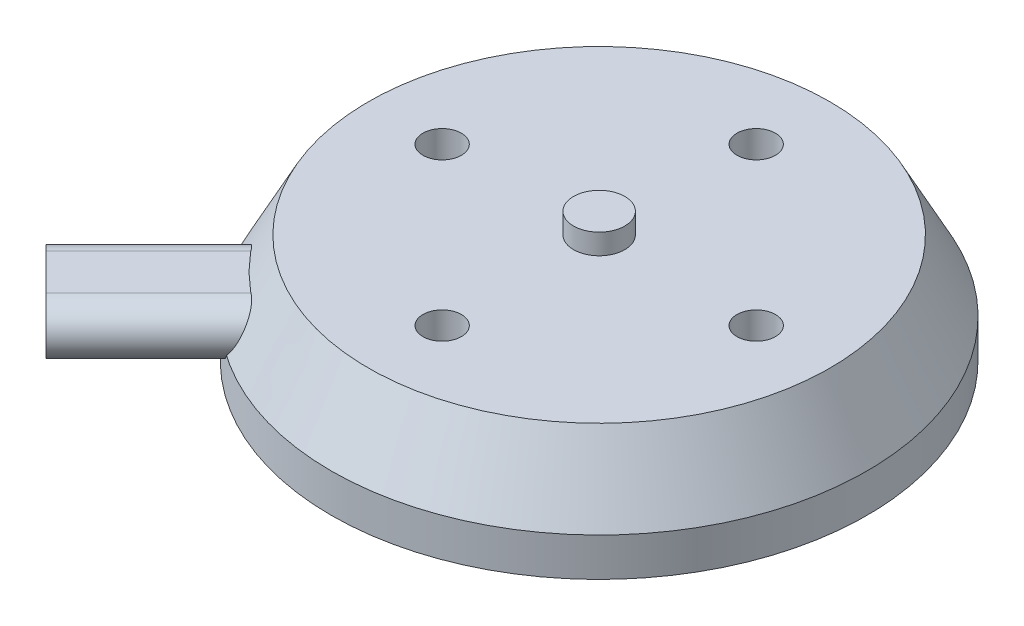
from build123d import *

# Parameters (mm, degrees)
ENL_V_MAT_EXTRU_1_REACH = 32.755
ESQUISSE4_R             = 1.5
ESQUISSE5_R             = 2
BOSS_EXTRU_2_DEPTH      = 1.6
BOSS_EXTRU_4_START      = -2
BOSS_EXTRU_4_DEPTH      = 4
CONG_3_RADIUS           = 2
CONG_3_LENGTH           = 30.513653989
CONG_2_RADIUS           = 2
CONG_2_LENGTH           = 30.513653989


with BuildPart() as part:
    # Esquisse3 → Révolution1 (revolve)
    with BuildSketch(Plane.XY, mode=Mode.PRIVATE) as r_volution1_sk:
        Polygon((-20.9, 0), (-20.9, 3), (-18, 8.5), (0, 8.5), (0, 0), align=None)
    revolve(r_volution1_sk.sketch.rotate(Axis((0, 0, 0), (0, 1, 0)), 270), axis=Axis((0, 0, 0), (0, 1, 0)))

    # Esquisse4 → Enlèv. mat.-Extru.1 (cut, up to next)
    with BuildSketch(Plane(origin=(0, 8.5, 0), x_dir=(1, 0, 0), z_dir=(0, 1, 0)), mode=Mode.PRIVATE) as enl_v_mat_extru_1_sk1:
        with Locations(Location((12.25, 0, 0), (0, 0, 270))):
            Circle(ESQUISSE4_R)
    enl_v_mat_extru_1_tool1 = extrude(enl_v_mat_extru_1_sk1.sketch, amount=-ENL_V_MAT_EXTRU_1_REACH, mode=Mode.PRIVATE) & part.part
    # Esquisse4 → Enlèv. mat.-Extru.1 (cut, up to next)
    with BuildSketch(Plane(origin=(0, 8.5, 0), x_dir=(1, 0, 0), z_dir=(0, 1, 0)), mode=Mode.PRIVATE) as enl_v_mat_extru_1_sk2:
        with Locations(Location((-12.25, 0, 0), (0, 0, 270))):
            Circle(ESQUISSE4_R)
    enl_v_mat_extru_1_tool2 = extrude(enl_v_mat_extru_1_sk2.sketch, amount=-ENL_V_MAT_EXTRU_1_REACH, mode=Mode.PRIVATE) & part.part
    # Esquisse4 → Enlèv. mat.-Extru.1 (cut, up to next)
    with BuildSketch(Plane(origin=(0, 8.5, 0), x_dir=(1, 0, 0), z_dir=(0, 1, 0)), mode=Mode.PRIVATE) as enl_v_mat_extru_1_sk3:
        with Locations(Location((0, -12.25, 0), (0, 0, 270))):
            Circle(ESQUISSE4_R)
    enl_v_mat_extru_1_tool3 = extrude(enl_v_mat_extru_1_sk3.sketch, amount=-ENL_V_MAT_EXTRU_1_REACH, mode=Mode.PRIVATE) & part.part
    # Esquisse4 → Enlèv. mat.-Extru.1 (cut, up to next)
    with BuildSketch(Plane(origin=(0, 8.5, 0), x_dir=(1, 0, 0), z_dir=(0, 1, 0)), mode=Mode.PRIVATE) as enl_v_mat_extru_1_sk4:
        with Locations(Location((0, 12.25, 0), (0, 0, 270))):
            Circle(ESQUISSE4_R)
    enl_v_mat_extru_1_tool4 = extrude(enl_v_mat_extru_1_sk4.sketch, amount=-ENL_V_MAT_EXTRU_1_REACH, mode=Mode.PRIVATE) & part.part
    add(enl_v_mat_extru_1_tool1.solids().sort_by_distance((12.25, 8.5, 0))[0], mode=Mode.SUBTRACT)
    add(enl_v_mat_extru_1_tool2.solids().sort_by_distance((-12.25, 8.5, 0))[0], mode=Mode.SUBTRACT)
    add(enl_v_mat_extru_1_tool3.solids().sort_by_distance((0, 8.5, 12.25))[0], mode=Mode.SUBTRACT)
    add(enl_v_mat_extru_1_tool4.solids().sort_by_distance((0, 8.5, -12.25))[0], mode=Mode.SUBTRACT)


with BuildPart() as body_2:
    # Esquisse5 → Boss.-Extru.2 (new body)
    with BuildSketch(Plane(origin=(0, 8.5, 0), x_dir=(1, 0, 0), z_dir=(0, 1, 0))):
        with Locations(Location((0, 0, 0), (0, 0, 270))):
            Circle(ESQUISSE5_R)
    extrude(amount=BOSS_EXTRU_2_DEPTH)


with BuildPart() as body_3:
    # Esquisse6 → Boss.-Extru.4 (new body)
    with BuildSketch(Plane.XZ.offset(BOSS_EXTRU_4_START)):
        Polygon((-24.404838779, 18.74798453), (-18.74798453, 24.404838779), (2.828427125, 2.828427125), (-2.828427125, -2.828427125), align=None)
    extrude(amount=-BOSS_EXTRU_4_DEPTH)

    # Congé3: full round fillet: the end face becomes a half cylinder, R = half its width
    cong_3_face = Plane((-7.959778703, 4, 13.616632952), x_dir=(-0.707106781187, 0, 0.707106781187), z_dir=(0.707106781187, 0, 0.707106781187))  # on the end face: x along it, z out of the body
    cong_3_slab = cong_3_face.offset(-CONG_3_RADIUS / 2) * Box(CONG_3_LENGTH, 2 * CONG_3_RADIUS, CONG_3_RADIUS, mode=Mode.PRIVATE)  # the body's end, R deep
    cong_3_round = Plane((-9.373992265, 4, 12.20241939), x_dir=(0.707106781187, 0, 0.707106781187), z_dir=(-0.707106781187, 0, 0.707106781187)) * Cylinder(CONG_3_RADIUS, CONG_3_LENGTH, mode=Mode.PRIVATE)  # its axis R under the face
    add(cong_3_slab - cong_3_round, mode=Mode.SUBTRACT)

    # Congé2: full round fillet: the end face becomes a half cylinder, R = half its width
    cong_2_face = Plane((-13.616632952, 4, 7.959778703), x_dir=(0.707106781187, 0, -0.707106781187), z_dir=(-0.707106781187, 0, -0.707106781187))  # on the end face: x along it, z out of the body
    cong_2_slab = cong_2_face.offset(-CONG_2_RADIUS / 2) * Box(CONG_2_LENGTH, 2 * CONG_2_RADIUS, CONG_2_RADIUS, mode=Mode.PRIVATE)  # the body's end, R deep
    cong_2_round = Plane((-12.20241939, 4, 9.373992265), x_dir=(-0.707106781187, 0, -0.707106781187), z_dir=(0.707106781187, 0, -0.707106781187)) * Cylinder(CONG_2_RADIUS, CONG_2_LENGTH, mode=Mode.PRIVATE)  # its axis R under the face
    add(cong_2_slab - cong_2_round, mode=Mode.SUBTRACT)


solid = Compound([part.part, body_2.part, body_3.part])
